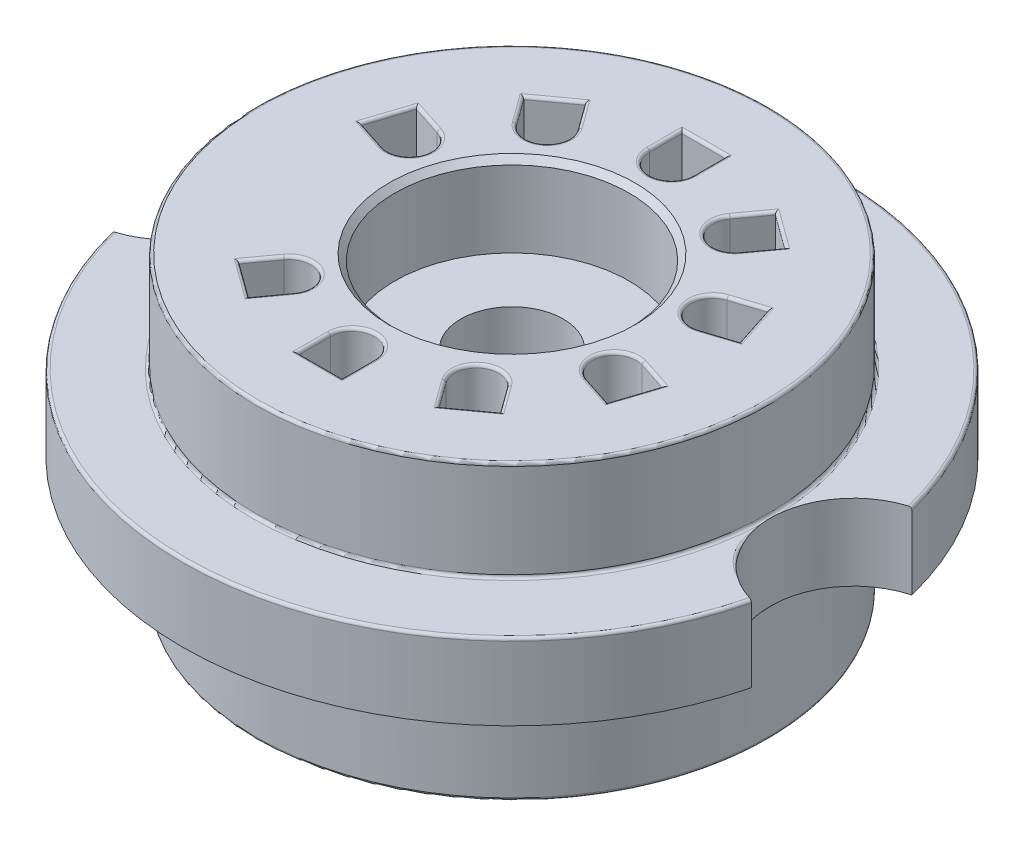
from build123d import *

# Parameters (mm, degrees)
ESBO_O1_R                   = 1.75
RESSALTO_EXTRUS_O1_DEPTH    = 10
ESBO_O2_R                   = 13.19845841
ESBO_O2_R_2                 = 8.75
CORTE_EXTRUS_O1_DEPTH       = 3.4
CORTE_EXTRUS_O2_START       = -4
ESBO_O3_R                   = 12.5
ESBO_O3_R_2                 = 8.75
CORTE_EXTRUS_O2_DEPTH       = 4
FILETE2_R                   = 0.1
FILETE3_R                   = 0.1
FILETE4_R                   = 0.1
ESBO_O4_R                   = 10.140553116
RESSALTO_EXTRUS_O2_DEPTH    = 0.001
RESSALTO_EXTRUS_O11_DEPTH   = 5.1
CORTE_EXTRUS_O8_DEPTH       = 14
CORTE_EXTRUS_O8_DEPTH_BACK  = 14.1
ESBO_O12_R                  = 3.021605033
CORTE_EXTRUS_O9_DEPTH       = 2.5
ESBO_O13_R                  = 4
CORTE_EXTRUS_O10_DEPTH      = 2.8
CHANFRO1_SIZE               = 0.2
CORTE_EXTRUS_O11_DEPTH      = 6
CORTE_EXTRUS_O11_DEPTH_BACK = 14


with BuildPart() as part:
    # Esboço1 → Ressalto-extrusão1 (new body)
    with BuildSketch(Plane(origin=(0, 0, 0), x_dir=(1, 0, 0), z_dir=(0, 1, 0))):
        with BuildLine():
            ThreePointArc((-8.991591662, -0.388946515), (-8.990299984, -0.407005732), (-8.989183206, -0.425076608))
            ThreePointArc((-8.989183206, -0.425076608), (-8.98759742, -0.458051309), (-8.986593961, -0.491048864))
            ThreePointArc((-8.986593961, -0.491048864), (-9.568011598, -1.887004156), (-10.99176775, -2.396568741))
            ThreePointArc((-10.99176775, -2.396568741), (-0.000864047, -11.249999967), (10.991399487, -2.39825714))
            ThreePointArc((10.991399487, -2.39825714), (10.864883928, -2.402532326), (10.738369027, -2.398237706))
            ThreePointArc((10.738369027, -2.398237706), (9.007870299, -0.314943136), (11.173276741, 1.311635192))
            ThreePointArc((11.173276741, 1.311635192), (0, 11.25), (-11.173276741, 1.311635192))
            ThreePointArc((-11.173276741, 1.311635192), (-9.706561588, 0.94355326), (-8.991591662, -0.388946515))
        make_face()
        with BuildLine():
            Line((-2.595019144, -4.847713646), (-3.244878392, -5.742168165))
            Line((-3.244878392, -5.742168165), (-4.458403884, -4.860490287))
            Line((-4.458403884, -4.860490287), (-3.808544636, -3.966035767))
            ThreePointArc((-3.808544636, -3.966035767), (-2.760942951, -3.800111961), (-2.595019144, -4.847713646))
        make_face(mode=Mode.SUBTRACT)
        with BuildLine():
            Line((0.75, -5.447196705), (0.75, -6.552803295))
            Line((0.75, -6.552803295), (-0.75, -6.552803295))
            Line((-0.75, -6.552803295), (-0.75, -5.447196705))
            ThreePointArc((-0.75, -5.447196705), (0, -4.697196705), (0.75, -5.447196705))
        make_face(mode=Mode.SUBTRACT)
        with BuildLine():
            Line((3.808544636, -3.966035767), (4.458403884, -4.860490287))
            Line((4.458403884, -4.860490287), (3.244878392, -5.742168165))
            Line((3.244878392, -5.742168165), (2.595019144, -4.847713646))
            ThreePointArc((2.595019144, -4.847713646), (2.760942951, -3.800111961), (3.808544636, -3.966035767))
        make_face(mode=Mode.SUBTRACT)
        with BuildLine():
            Line((5.412354668, -0.969983966), (6.463849019, -1.311635192))
            Line((6.463849019, -1.311635192), (6.000323528, -2.738219966))
            Line((6.000323528, -2.738219966), (4.948829176, -2.396568741))
            ThreePointArc((4.948829176, -2.396568741), (4.467299535, -1.451513608), (5.412354668, -0.969983966))
        make_face(mode=Mode.SUBTRACT)
        with BuildLine():
            Line((-5.412354668, 0.969983966), (-6.463849019, 1.311635192))
            Line((-6.463849019, 1.311635192), (-6.000323528, 2.738219966))
            Line((-6.000323528, 2.738219966), (-4.948829176, 2.396568741))
            ThreePointArc((-4.948829176, 2.396568741), (-4.467299535, 1.451513608), (-5.412354668, 0.969983966))
        make_face(mode=Mode.SUBTRACT)
        with BuildLine():
            Line((-3.808544636, 3.966035767), (-4.458403884, 4.860490287))
            Line((-4.458403884, 4.860490287), (-3.244878392, 5.742168165))
            Line((-3.244878392, 5.742168165), (-2.595019144, 4.847713646))
            ThreePointArc((-2.595019144, 4.847713646), (-2.760942951, 3.800111961), (-3.808544636, 3.966035767))
        make_face(mode=Mode.SUBTRACT)
        with Locations(Location((0, 0, 0), (0, 0, 270))):
            Circle(ESBO_O1_R, mode=Mode.SUBTRACT)
        with BuildLine():
            Line((4.948829176, 2.396568741), (6.000323528, 2.738219966))
            Line((6.000323528, 2.738219966), (6.463849019, 1.311635192))
            Line((6.463849019, 1.311635192), (5.412354668, 0.969983966))
            ThreePointArc((5.412354668, 0.969983966), (4.467299535, 1.451513608), (4.948829176, 2.396568741))
        make_face(mode=Mode.SUBTRACT)
        with BuildLine():
            Line((2.595019144, 4.847713646), (3.244878392, 5.742168165))
            Line((3.244878392, 5.742168165), (4.458403884, 4.860490287))
            Line((4.458403884, 4.860490287), (3.808544636, 3.966035767))
            ThreePointArc((3.808544636, 3.966035767), (2.760942951, 3.800111961), (2.595019144, 4.847713646))
        make_face(mode=Mode.SUBTRACT)
        with BuildLine():
            ThreePointArc((0.75, 5.447196705), (0, 4.697196705), (-0.75, 5.447196705))
            Line((-0.75, 5.447196705), (-0.75, 6.552803295))
            Line((-0.75, 6.552803295), (0.75, 6.552803295))
            Line((0.75, 6.552803295), (0.75, 5.447196705))
        make_face(mode=Mode.SUBTRACT)
    extrude(amount=RESSALTO_EXTRUS_O1_DEPTH)

    # Esboço2 → Corte-extrusão1 (cut)
    with BuildSketch(Plane(origin=(0, 10, 0), x_dir=(1, 0, 0), z_dir=(0, 1, 0))):
        Circle(ESBO_O2_R)
        with Locations(Location((0, 0, 0), (0, 0, 270))):
            Circle(ESBO_O2_R_2, mode=Mode.SUBTRACT)
    extrude(amount=-CORTE_EXTRUS_O1_DEPTH, mode=Mode.SUBTRACT)

    # Esboço3 → Corte-extrusão2 (cut)
    with BuildSketch(Plane.XZ.offset(CORTE_EXTRUS_O2_START)):
        Circle(ESBO_O3_R)
        with Locations(Location((0, 0, 0), (0, 0, 90))):
            Circle(ESBO_O3_R_2, mode=Mode.SUBTRACT)
    extrude(amount=CORTE_EXTRUS_O2_DEPTH, mode=Mode.SUBTRACT)

    # Filete2
    filete2_edges = [part.edges().sort_by_distance(p)[0] for p in [
        (-0.000864047, 6.6, 11.249999967),
        (0, 6.6, -11.25),
        (-8.988395031, 6.6, 0.439963535),
        (8.997395575, 6.6, 0.441096789),
        (0, 6.6, -8.75),
    ]]
    fillet(filete2_edges, radius=FILETE2_R)

    # Filete3
    filete3_edges = [part.edges().sort_by_distance(p)[0] for p in [
        (6.232086273, 10, 2.024927579),
        (5.474576352, 10, 2.567394353),
        (0, 10, -1.75),
        (4.467299535, 10, -1.451513608),
        (5.474576352, 10, -2.567394353),
        (6.232086273, 10, -2.024927579),
        (5.938101844, 10, -1.140809579),
        (0, 10, -8.75),
        (2.760942951, 10, -3.800111961),
        (2.919948768, 10, -5.294940905),
        (3.851641138, 10, -5.301329226),
        (4.13347426, 10, -4.413263027),
        (-2.760942951, 10, -3.800111961),
        (0, 10, -4.697196705),
        (-0.75, 10, -6),
        (0, 10, -6.552803295),
        (0.75, 10, -6),
        (-4.13347426, 10, -4.413263027),
        (-3.851641138, 10, -5.301329226),
        (-2.919948768, 10, -5.294940905),
        (-4.467299535, 10, -1.451513608),
        (-5.938101844, 10, -1.140809579),
        (-6.232086273, 10, -2.024927579),
        (-5.474576352, 10, -2.567394353),
        (-2.760942951, 10, 3.800111961),
        (-2.919948768, 10, 5.294940905),
        (-3.851641138, 10, 5.301329226),
        (-4.13347426, 10, 4.413263027),
        (0, 10, 4.697196705),
        (0.75, 10, 6),
        (0, 10, 6.552803295),
        (-0.75, 10, 6),
        (2.760942951, 10, 3.800111961),
        (4.13347426, 10, 4.413263027),
        (3.851641138, 10, 5.301329226),
        (2.919948768, 10, 5.294940905),
        (4.467299535, 10, 1.451513608),
        (5.938101844, 10, 1.140809579),
    ]]
    fillet(filete3_edges, radius=FILETE3_R)

    # Filete4
    filete4_edges = [part.edges().sort_by_distance(p)[0] for p in [
        (0, 4, -8.75),
        (0, 0, -8.75),
    ]]
    fillet(filete4_edges, radius=FILETE4_R)

    # Esboço4 → Ressalto-extrusão2 (add)
    with BuildSketch(Plane.XZ):
        with Locations(Location((0, 0, 0), (0, 0, 270))):
            Circle(ESBO_O4_R)
    extrude(amount=RESSALTO_EXTRUS_O2_DEPTH)

    # Esboço5 → Ressalto-extrusão11 (add)
    with BuildSketch(Plane(origin=(0, 0, 0), x_dir=(1, 0, 0), z_dir=(0, 1, 0))):
        with BuildLine():
            Line((4.13347426, 4.413263027), (2.919948768, 5.294940905))
            Line((2.919948768, 5.294940905), (2.595019144, 4.847713646))
            ThreePointArc((2.595019144, 4.847713646), (2.760942951, 3.800111961), (3.808544636, 3.966035767))
            Line((3.808544636, 3.966035767), (4.13347426, 4.413263027))
        make_face()
        with BuildLine():
            Line((-0.75, 6), (0.75, 6))
            Line((0.75, 6), (0.75, 5.447196705))
            ThreePointArc((0.75, 5.447196705), (0, 4.697196705), (-0.75, 5.447196705))
            Line((-0.75, 5.447196705), (-0.75, 6))
        make_face()
        with BuildLine():
            Line((-5.938101844, 1.140809579), (-5.412354668, 0.969983966))
            ThreePointArc((-5.412354668, 0.969983966), (-4.840099047, 1.015021461), (-4.467299535, 1.451513608))
            ThreePointArc((-4.467299535, 1.451513608), (-4.512337029, 2.023769228), (-4.948829176, 2.396568741))
            Line((-4.948829176, 2.396568741), (-5.474576352, 2.567394353))
            Line((-5.474576352, 2.567394353), (-5.938101844, 1.140809579))
        make_face()
        with BuildLine():
            Line((5.474576352, 2.567394353), (4.948829176, 2.396568741))
            ThreePointArc((4.948829176, 2.396568741), (4.467299535, 1.451513608), (5.412354668, 0.969983966))
            Line((5.412354668, 0.969983966), (5.938101844, 1.140809579))
            Line((5.938101844, 1.140809579), (5.474576352, 2.567394353))
        make_face()
        with BuildLine():
            Line((5.938101844, -1.140809579), (5.474576352, -2.567394353))
            Line((5.474576352, -2.567394353), (4.948829176, -2.396568741))
            ThreePointArc((4.948829176, -2.396568741), (4.467299535, -1.451513608), (5.412354668, -0.969983966))
            Line((5.412354668, -0.969983966), (5.938101844, -1.140809579))
        make_face()
        with BuildLine():
            Line((2.919948768, -5.294940905), (4.13347426, -4.413263027))
            Line((4.13347426, -4.413263027), (3.808544636, -3.966035767))
            ThreePointArc((3.808544636, -3.966035767), (2.760942951, -3.800111961), (2.595019144, -4.847713646))
            Line((2.595019144, -4.847713646), (2.919948768, -5.294940905))
        make_face()
        with BuildLine():
            Line((-0.75, -6), (0.75, -6))
            Line((0.75, -6), (0.75, -5.447196705))
            ThreePointArc((0.75, -5.447196705), (0, -4.697196705), (-0.75, -5.447196705))
            Line((-0.75, -5.447196705), (-0.75, -6))
        make_face()
        with BuildLine():
            Line((-2.919948768, -5.294940905), (-4.13347426, -4.413263027))
            Line((-4.13347426, -4.413263027), (-3.808544636, -3.966035767))
            ThreePointArc((-3.808544636, -3.966035767), (-2.760942951, -3.800111961), (-2.595019144, -4.847713646))
            Line((-2.595019144, -4.847713646), (-2.919948768, -5.294940905))
        make_face()
        with BuildLine():
            Line((-3.808544636, 3.966035767), (-4.13347426, 4.413263027))
            Line((-4.13347426, 4.413263027), (-2.919948768, 5.294940905))
            Line((-2.919948768, 5.294940905), (-2.595019144, 4.847713646))
            ThreePointArc((-2.595019144, 4.847713646), (-2.455425021, 4.333040944), (-2.693155108, 3.855695247))
            ThreePointArc((-2.693155108, 3.855695247), (-3.275615652, 3.660517838), (-3.808544636, 3.966035767))
        make_face()
    extrude(amount=RESSALTO_EXTRUS_O11_DEPTH)

    # Esboço11 → Corte-extrusão8 (cut, two sides: drawn at the far end of the back side and taken through both)
    with BuildSketch(Plane(origin=(0, 0, 0), x_dir=(0, 0, -1), z_dir=(1, 0, 0)).offset(-CORTE_EXTRUS_O8_DEPTH_BACK)):
        Polygon((13.016703691, 0), (-12.703990089, 0), (-13.35547676, -1.671723513), (13.77242823, -2.922577922), align=None)
    extrude(amount=CORTE_EXTRUS_O8_DEPTH + CORTE_EXTRUS_O8_DEPTH_BACK, mode=Mode.SUBTRACT)

    # Esboço12 → Corte-extrusão9 (cut)
    with BuildSketch(Plane(origin=(0, 10, 0), x_dir=(1, 0, 0), z_dir=(0, 1, 0))):
        with Locations(Location((0, 0, 0), (0, 0, 270))):
            Circle(ESBO_O12_R)
    extrude(amount=-CORTE_EXTRUS_O9_DEPTH, mode=Mode.SUBTRACT)

    # Esboço13 → Corte-extrusão10 (cut)
    with BuildSketch(Plane(origin=(0, 10, 0), x_dir=(1, 0, 0), z_dir=(0, 1, 0))):
        with Locations(Location((0, 0, 0), (0, 0, 270))):
            Circle(ESBO_O13_R)
    extrude(amount=-CORTE_EXTRUS_O10_DEPTH, mode=Mode.SUBTRACT)

    # Chanfro1
    chanfro1_edges = [part.edges().sort_by_distance(p)[0] for p in [
        (0, 10, -4),
    ]]
    chamfer(chanfro1_edges, length=CHANFRO1_SIZE)

    # Esboço14 → Corte-extrusão11 (cut, two sides: drawn at the far end of the back side and taken through both)
    with BuildSketch(Plane(origin=(0, 6.6, 0), x_dir=(1, 0, 0), z_dir=(0, 1, 0)).offset(-CORTE_EXTRUS_O11_DEPTH_BACK)):
        with BuildLine():
            Line((-11.180335415, -2.8), (-11.044249085, -2.8))
            ThreePointArc((-11.044249085, -2.8), (-8.82571479, 0.055566513), (-11.180335415, 2.800000196))
            Line((-11.180335415, 2.800000196), (-11.180335415, -2.8))
        make_face()
        with BuildLine():
            Line((11.180335415, -2.8), (11.180335415, 2.800000196))
            ThreePointArc((11.180335415, 2.800000196), (8.82189166, 9.8e-08), (11.180335415, -2.8))
        make_face()
    extrude(amount=CORTE_EXTRUS_O11_DEPTH + CORTE_EXTRUS_O11_DEPTH_BACK, mode=Mode.SUBTRACT)


solid = part.part
